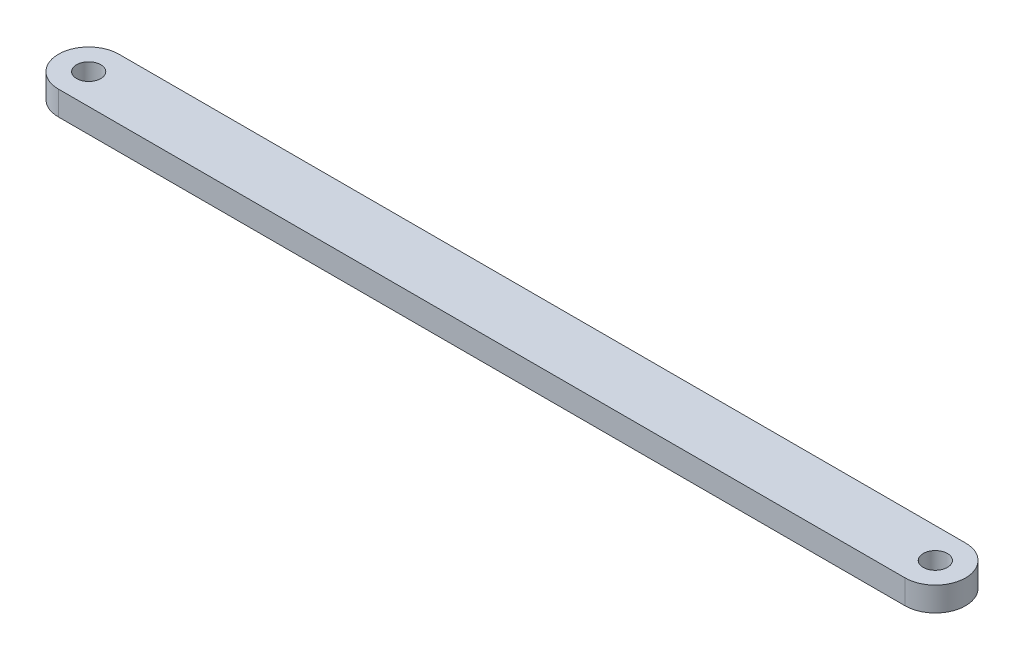
from build123d import *

# Parameters (mm, degrees)
SKETCH1_R           = 1
BOSS_EXTRUDE1_DEPTH = 2


with BuildPart() as part:
    # Sketch1 → Boss-Extrude1 (new body)
    with BuildSketch(Plane(origin=(0, 0, 0), x_dir=(1, 0, 0), z_dir=(0, 1, 0))):
        with BuildLine():
            Line((0, 2.5), (70, 2.5))
            ThreePointArc((70, 2.5), (72.5, 0), (70, -2.5))
            Line((70, -2.5), (0, -2.5))
            ThreePointArc((0, -2.5), (-2.5, 0), (0, 2.5))
        make_face()
        with Locations(Location((0, 0, 0), (0, 0, 270))):
            Circle(SKETCH1_R, mode=Mode.SUBTRACT)
        with Locations(Location((70, 0, 0), (0, 0, 270))):
            Circle(SKETCH1_R, mode=Mode.SUBTRACT)
    extrude(amount=BOSS_EXTRUDE1_DEPTH)


solid = part.part
